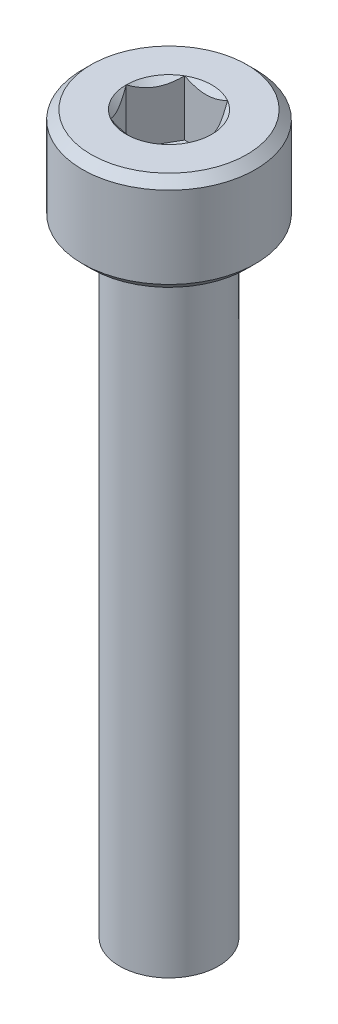
from build123d import *

# Parameters (mm, degrees)
SKETCH1_R           = 3.5
BOSS_EXTRUDE1_DEPTH = 4
CUT_EXTRUDE1_DEPTH  = 2.25
CHAMFER1_SIZE       = 0.35
SKETCH_1_R          = 2
EXTRUDE_1_DEPTH     = 25


with BuildPart() as part:
    # Sketch1 → Boss-Extrude1 (new body)
    with BuildSketch(Plane(origin=(0, 0, 0), x_dir=(1, 0, 0), z_dir=(0, 1, 0))):
        with Locations(Location((0, 0, 0), (0, 0, 270))):
            Circle(SKETCH1_R)
    extrude(amount=BOSS_EXTRUDE1_DEPTH)

    # Sketch2 → Cut-Extrude1 (cut)
    with BuildSketch(Plane(origin=(0, 4, 0), x_dir=(1, 0, 0), z_dir=(0, 1, 0))):
        Polygon((0.866025404, 1.5), (-0.866025404, 1.5), (-1.732050808, 0), (-0.866025404, -1.5), (0.866025404, -1.5), (1.732050808, 0), align=None)
    extrude(amount=-CUT_EXTRUDE1_DEPTH, mode=Mode.SUBTRACT)

    # Cut-Extrude2 cone 1 section (through the dimple's axis) → Cut-Extrude2 (revolve, cut)
    with BuildSketch(Plane(origin=(0, 4, 0), x_dir=(0, 0, 1), z_dir=(1, 0, 0))):
        Polygon((0, 0), (1.732050808, 0), (0, 1.732050808), align=None)
    revolve(axis=Axis((0, 4, 0), (0, -1, 0)), mode=Mode.SUBTRACT)

    # Chamfer1
    chamfer1_edges = [part.edges().sort_by_distance(p)[0] for p in [
        (0, 0, -3.5),
        (0, 4, -3.5),
    ]]
    chamfer(chamfer1_edges, length=CHAMFER1_SIZE)

    # 草图1 → 凸台-拉伸1 (add)
    with BuildSketch(Plane(origin=(0, 0, 0), x_dir=(-1, 0, 0), z_dir=(0, -1, 0))):
        with Locations(Location((0, 0, 0), (0, 0, 90))):
            Circle(SKETCH_1_R)
    extrude(amount=EXTRUDE_1_DEPTH)


solid = part.part
